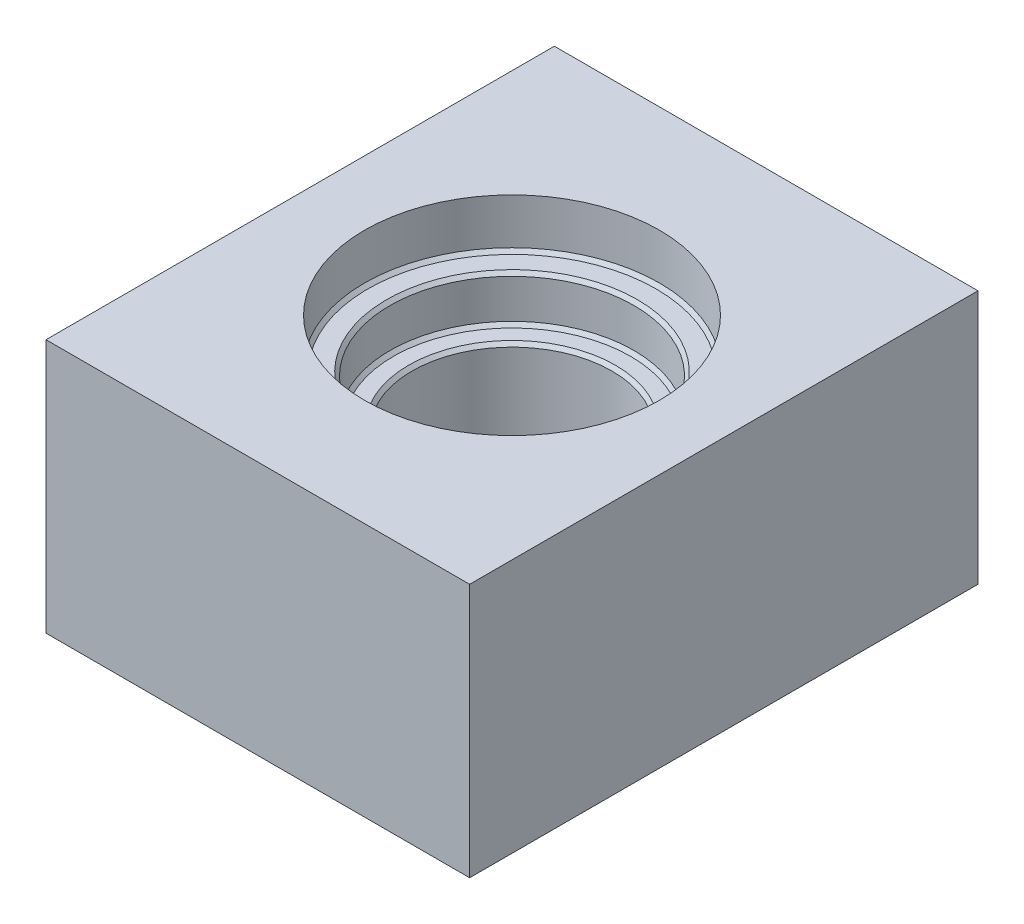
from build123d import *

# Parameters (mm, degrees)
SKETCH1_W           = 250
SKETCH1_H           = 150
BOSS_EXTRUDE1_DEPTH = 150


with BuildPart() as part:
    # Sketch1 → Boss-Extrude1 (new body)
    with BuildSketch(Plane.XY):
        with Locations((0, 75)):
            Rectangle(SKETCH1_W, SKETCH1_H)
    boss_extrude1 = extrude(amount=-BOSS_EXTRUDE1_DEPTH)

    # Sketch2 → Cut-Revolve1 (revolve, cut)
    with BuildSketch(Plane.XY):
        Polygon((0, 150), (87, 150), (87, 123), (85, 121), (74, 121), (72, 119), (72, 96), (70, 94), (61, 94), (59, 92), (59, 46), (57, 44), (43, 44), (41, 42), (41, 36), (39, 34), (0, 34), align=None)
    cut_revolve1 = revolve(axis=Axis((0, 0, 0), (0, 1, 0)), mode=Mode.SUBTRACT)

    # Mirror1: Boss-Extrude1, Cut-Revolve1 across plane
    add(boss_extrude1.mirror(Plane(origin=(0, 0, 0), x_dir=(1, 0, 0), z_dir=(0, 0, -1))))
    add(cut_revolve1.mirror(Plane(origin=(0, 0, 0), x_dir=(1, 0, 0), z_dir=(0, 0, -1))), mode=Mode.SUBTRACT)


solid = part.part
